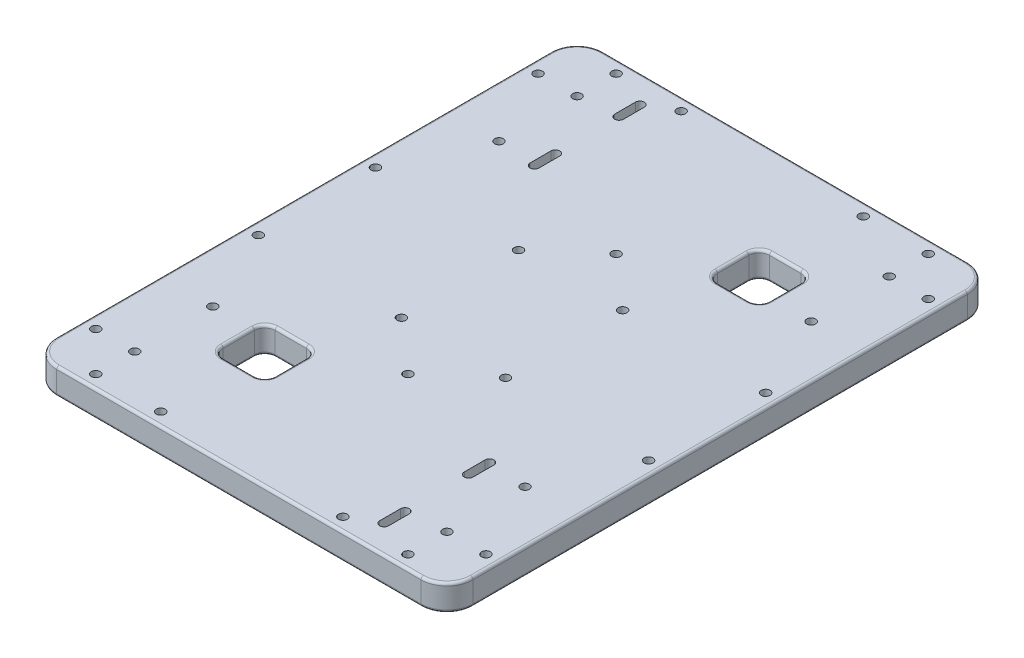
from build123d import *

# Parameters (mm, degrees)
SKETCH1_W           = 160
SKETCH1_H           = 210
BOSS_EXTRUDE1_DEPTH = 10
SKETCH2_R           = 1.7
CUT_EXTRUDE1_DEPTH  = 10
FILLET1_R           = 10
CUT_EXTRUDE2_DEPTH  = 44.6
SKETCH4_R           = 1.7
CUT_EXTRUDE3_DEPTH  = 44.6
SKETCH5_R           = 1.7
CUT_EXTRUDE4_DEPTH  = 32
SKETCH6_R           = 1.7
CUT_EXTRUDE5_DEPTH  = 35
SKETCH7_R           = 1.7
CUT_EXTRUDE6_DEPTH  = 42
SKETCH8_R           = 1.7
CUT_EXTRUDE7_DEPTH  = 42
FILLET2_R           = 1
SKETCH9_W           = 20
SKETCH9_H           = 20
CUT_EXTRUDE8_DEPTH  = 41
FILLET3_R           = 4
FILLET4_R           = 1


with BuildPart() as part:
    # Sketch1 → Boss-Extrude1 (new body)
    with BuildSketch(Plane(origin=(0, 0, 0), x_dir=(1, 0, 0), z_dir=(0, 1, 0))):
        Rectangle(SKETCH1_W, SKETCH1_H)
    extrude(amount=BOSS_EXTRUDE1_DEPTH)

    # Sketch2 → Cut-Extrude1 (cut)
    with BuildSketch(Plane(origin=(0, 10, 0), x_dir=(1, 0, 0), z_dir=(0, 1, 0))):
        with Locations(Location((-75, 22.5, 0), (0, 0, 270))):
            Circle(SKETCH2_R)
        with Locations(Location((-75, -22.5, 0), (0, 0, 270))):
            Circle(SKETCH2_R)
        with Locations(Location((75, 22.5, 0), (0, 0, 270))):
            Circle(SKETCH2_R)
        with Locations(Location((75, -22.5, 0), (0, 0, 270))):
            Circle(SKETCH2_R)
    extrude(amount=-CUT_EXTRUDE1_DEPTH, mode=Mode.SUBTRACT)

    # Fillet1
    fillet1_edges = [part.edges().sort_by_distance(p)[0] for p in [
        (80, 5, 105),
        (-80, 5, 105),
        (-80, 5, -105),
        (80, 5, -105),
    ]]
    fillet(fillet1_edges, radius=FILLET1_R)

    # Sketch3 → Cut-Extrude2 (cut)
    with BuildSketch(Plane(origin=(0, 10, 0), x_dir=(1, 0, 0), z_dir=(0, 1, 0))):
        with BuildLine():
            Line((43.4, -86.25), (43.4, -94.25))
            ThreePointArc((43.4, -94.25), (45.1, -95.95), (46.8, -94.25))
            Line((46.8, -94.25), (46.8, -86.25))
            ThreePointArc((46.8, -86.25), (45.1, -84.55), (43.4, -86.25))
        make_face()
        with BuildLine():
            Line((-46.8, 94.25), (-46.8, 86.25))
            ThreePointArc((-46.8, 86.25), (-45.1, 84.55), (-43.4, 86.25))
            Line((-43.4, 86.25), (-43.4, 94.25))
            ThreePointArc((-43.4, 94.25), (-45.1, 95.95), (-46.8, 94.25))
        make_face()
        with BuildLine():
            ThreePointArc((46.8, -53.75), (45.1, -52.05), (43.4, -53.75))
            Line((43.4, -53.75), (43.4, -61.75))
            ThreePointArc((43.4, -61.75), (45.1, -63.45), (46.8, -61.75))
            Line((46.8, -61.75), (46.8, -53.75))
        make_face()
        with BuildLine():
            Line((-46.8, 61.75), (-46.8, 53.75))
            ThreePointArc((-46.8, 53.75), (-45.1, 52.05), (-43.4, 53.75))
            Line((-43.4, 53.75), (-43.4, 61.75))
            ThreePointArc((-43.4, 61.75), (-45.1, 63.45), (-46.8, 61.75))
        make_face()
    extrude(amount=-CUT_EXTRUDE2_DEPTH, mode=Mode.SUBTRACT)

    # Sketch4 → Cut-Extrude3 (cut)
    with BuildSketch(Plane(origin=(0, 10, 0), x_dir=(1, 0, 0), z_dir=(0, 1, 0))):
        with Locations(Location((20, 22.5, 0), (0, 0, 270))):
            Circle(SKETCH4_R)
        with Locations(Location((20, -22.5, 0), (0, 0, 270))):
            Circle(SKETCH4_R)
        with Locations(Location((-20, -22.5, 0), (0, 0, 270))):
            Circle(SKETCH4_R)
        with Locations(Location((-20, 22.5, 0), (0, 0, 270))):
            Circle(SKETCH4_R)
    extrude(amount=-CUT_EXTRUDE3_DEPTH, mode=Mode.SUBTRACT)

    # Sketch5 → Cut-Extrude4 (cut)
    with BuildSketch(Plane(origin=(0, 10, 0), x_dir=(1, 0, 0), z_dir=(0, 1, 0))):
        with Locations(Location((-75, -85, 0), (0, 0, 270))):
            Circle(SKETCH5_R)
        with Locations(Location((-60, -100, 0), (0, 0, 270))):
            Circle(SKETCH5_R)
        with Locations(Location((60, -100, 0), (0, 0, 270))):
            Circle(SKETCH5_R)
        with Locations(Location((75, -85, 0), (0, 0, 270))):
            Circle(SKETCH5_R)
        with Locations(Location((-60, 100, 0), (0, 0, 270))):
            Circle(SKETCH5_R)
        with Locations(Location((-75, 85, 0), (0, 0, 270))):
            Circle(SKETCH5_R)
        with Locations(Location((60, 100, 0), (0, 0, 270))):
            Circle(SKETCH5_R)
        with Locations(Location((75, 85, 0), (0, 0, 270))):
            Circle(SKETCH5_R)
    extrude(amount=-CUT_EXTRUDE4_DEPTH, mode=Mode.SUBTRACT)

    # Sketch6 → Cut-Extrude5 (cut)
    with BuildSketch(Plane.XZ):
        with Locations(Location((-60, 85, 0), (0, 0, 270))):
            Circle(SKETCH6_R)
        with Locations(Location((-60, 55, 0), (0, 0, 270))):
            Circle(SKETCH6_R)
        with Locations(Location((60, 55, 0), (0, 0, 270))):
            Circle(SKETCH6_R)
        with Locations(Location((60, 85, 0), (0, 0, 270))):
            Circle(SKETCH6_R)
        with Locations(Location((-60, -85, 0), (0, 0, 270))):
            Circle(SKETCH6_R)
        with Locations(Location((-60, -55, 0), (0, 0, 270))):
            Circle(SKETCH6_R)
        with Locations(Location((60, -55, 0), (0, 0, 270))):
            Circle(SKETCH6_R)
        with Locations(Location((60, -85, 0), (0, 0, 270))):
            Circle(SKETCH6_R)
    extrude(amount=-CUT_EXTRUDE5_DEPTH, mode=Mode.SUBTRACT)

    # Sketch7 → Cut-Extrude6 (cut)
    with BuildSketch(Plane(origin=(0, 10, 0), x_dir=(1, 0, 0), z_dir=(0, 1, 0))):
        with Locations(Location((0, 40, 0), (0, 0, 270))):
            Circle(SKETCH7_R)
        with Locations(Location((0, -40, 0), (0, 0, 270))):
            Circle(SKETCH7_R)
    extrude(amount=-CUT_EXTRUDE6_DEPTH, mode=Mode.SUBTRACT)

    # Sketch8 → Cut-Extrude7 (cut)
    with BuildSketch(Plane(origin=(0, 10, 0), x_dir=(1, 0, 0), z_dir=(0, 1, 0))):
        with Locations(Location((-35, -100, 0), (0, 0, 270))):
            Circle(SKETCH8_R)
        with Locations(Location((35, -100, 0), (0, 0, 270))):
            Circle(SKETCH8_R)
        with Locations(Location((35, 100, 0), (0, 0, 270))):
            Circle(SKETCH8_R)
        with Locations(Location((-35, 100, 0), (0, 0, 270))):
            Circle(SKETCH8_R)
    extrude(amount=-CUT_EXTRUDE7_DEPTH, mode=Mode.SUBTRACT)

    # Fillet2
    fillet2_edges = [part.edges().sort_by_distance(p)[0] for p in [
        (0, 0, -105),
        (0, 10, -105),
        (80, 0, 0),
        (0, 0, 105),
        (-80, 0, 0),
        (-77.071067812, 0, -102.071067812),
        (-77.071067812, 0, 102.071067812),
        (77.071067812, 0, 102.071067812),
        (77.071067812, 0, -102.071067812),
        (80, 10, 0),
        (-80, 10, 0),
        (0, 10, 105),
        (-77.071067812, 10, -102.071067812),
        (-77.071067812, 10, 102.071067812),
        (77.071067812, 10, 102.071067812),
        (77.071067812, 10, -102.071067812),
    ]]
    fillet(fillet2_edges, radius=FILLET2_R)

    # Sketch9 → Cut-Extrude8 (cut)
    with BuildSketch(Plane(origin=(0, 10, 0), x_dir=(1, 0, 0), z_dir=(0, 1, 0))):
        with Locations((-35, -60)):
            Rectangle(SKETCH9_W, SKETCH9_H)
        with Locations((35, 60)):
            Rectangle(SKETCH9_W, SKETCH9_H)
    extrude(amount=-CUT_EXTRUDE8_DEPTH, mode=Mode.SUBTRACT)

    # Fillet3
    fillet3_edges = [part.edges().sort_by_distance(p)[0] for p in [
        (-45, 5, 70),
        (-45, 5, 50),
        (-25, 5, 50),
        (-25, 5, 70),
        (25, 5, -50),
        (25, 5, -70),
        (45, 5, -70),
        (45, 5, -50),
    ]]
    fillet(fillet3_edges, radius=FILLET3_R)

    # Fillet4
    fillet4_edges = [part.edges().sort_by_distance(p)[0] for p in [
        (35, 10, -50),
        (35, 0, -50),
        (25, 10, -60),
        (25, 0, -60),
        (35, 10, -70),
        (35, 0, -70),
        (45, 10, -60),
        (45, 0, -60),
        (-25, 10, 60),
        (-25, 0, 60),
        (-35, 10, 70),
        (-35, 0, 70),
        (-45, 10, 60),
        (-45, 0, 60),
        (-35, 10, 50),
        (-35, 0, 50),
        (26.171572875, 10, -51.171572875),
        (26.171572875, 0, -51.171572875),
        (26.171572875, 10, -68.828427125),
        (26.171572875, 0, -68.828427125),
        (43.828427125, 10, -68.828427125),
        (43.828427125, 0, -68.828427125),
        (43.828427125, 10, -51.171572875),
        (43.828427125, 0, -51.171572875),
        (-26.171572875, 10, 68.828427125),
        (-26.171572875, 0, 68.828427125),
        (-43.828427125, 10, 68.828427125),
        (-43.828427125, 0, 68.828427125),
        (-26.171572875, 10, 51.171572875),
        (-26.171572875, 0, 51.171572875),
        (-43.828427125, 10, 51.171572875),
        (-43.828427125, 0, 51.171572875),
    ]]
    fillet(fillet4_edges, radius=FILLET4_R)


solid = part.part
